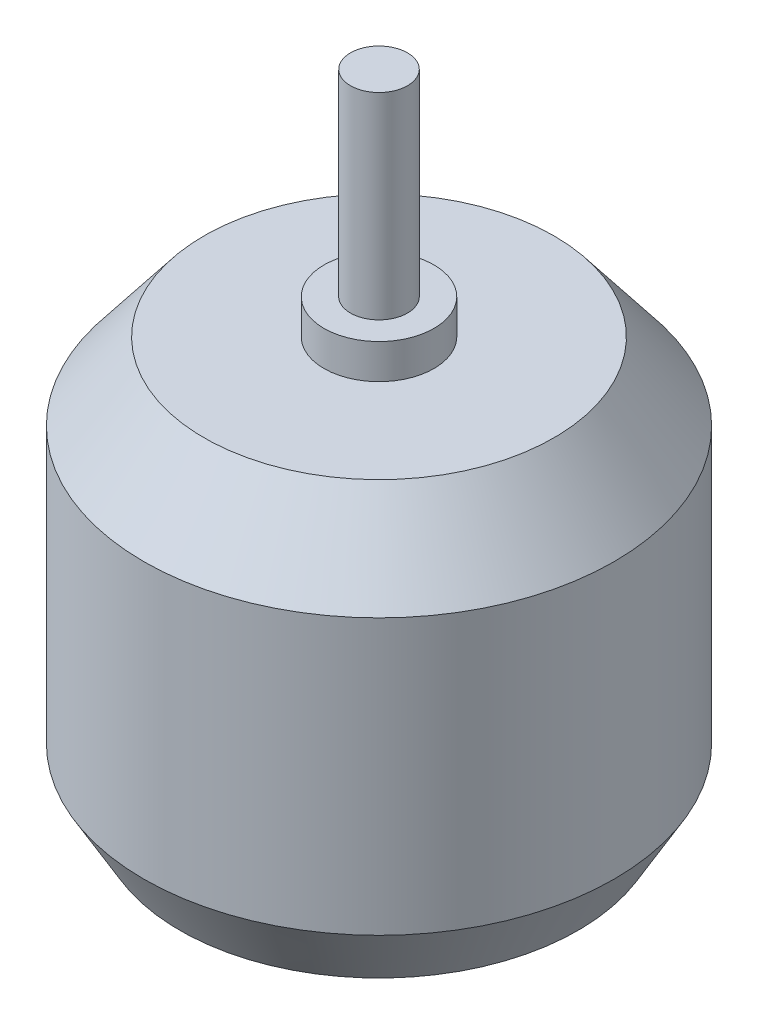
from build123d import *

# Parameters (mm, degrees)
SKETCH2_R           = 3
BOSS_EXTRUDE1_DEPTH = 24.39
SKETCH4_R           = 5.79
BOSS_EXTRUDE2_DEPTH = 3.66


with BuildPart() as part:
    # Sketch1 → Revolve1 (revolve)
    with BuildSketch(Plane.XY, mode=Mode.PRIVATE) as revolve1_sk:
        Polygon((0, 0), (0, 43.64), (18.418686804, 43.64), (24.76, 35.523489238), (24.76, 6.581793069), (20.96, 0), align=None)
    revolve(revolve1_sk.sketch.rotate(Axis((0, 0, 0), (0, 1, 0)), 90), axis=Axis((0, 0, 0), (0, 1, 0)))

    # Sketch2 → Boss-Extrude1 (add)
    with BuildSketch(Plane(origin=(0, 43.64, 0), x_dir=(1, 0, 0), z_dir=(0, 1, 0))):
        with Locations(Location((0, 0, 0), (0, 0, 270))):
            Circle(SKETCH2_R)
    extrude(amount=BOSS_EXTRUDE1_DEPTH)

    # Sketch4 → Boss-Extrude2 (add)
    with BuildSketch(Plane(origin=(0, 43.64, 0), x_dir=(1, 0, 0), z_dir=(0, 1, 0))):
        with Locations(Location((0, 0, 0), (0, 0, 270))):
            Circle(SKETCH4_R)
    extrude(amount=BOSS_EXTRUDE2_DEPTH)


solid = part.part
